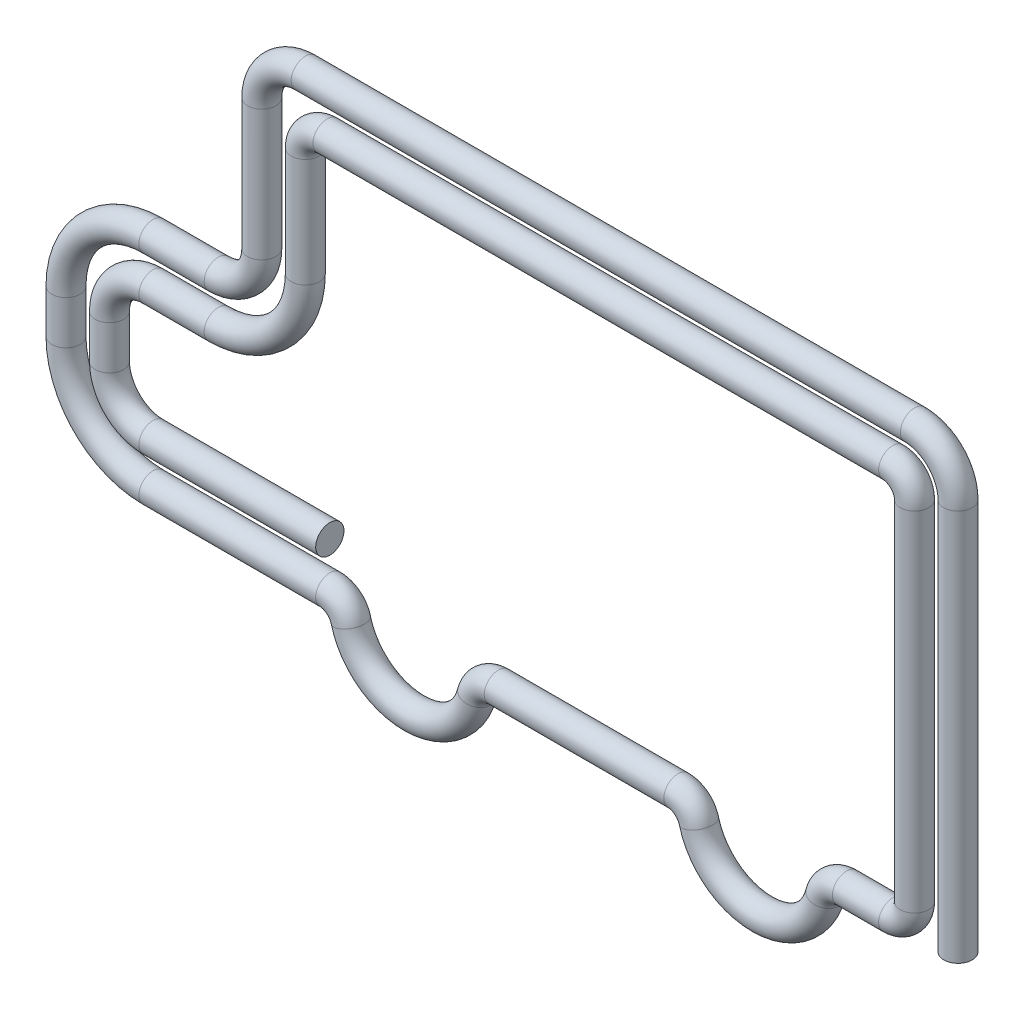
from build123d import *

# Parameters (mm, degrees)
SKETCH_3_R = 0.65


with BuildPart() as part:
    # По траектории1: sweep along a path in Эскиз2
    with BuildLine(Plane.XY) as sweep_1_path:
        Line((17, -10), (17, 8))
        ThreePointArc((17, 8), (16.414213562, 9.414213562), (15, 10))
        Line((15, 10), (-13, 10))
        ThreePointArc((-13, 10), (-14.414213562, 9.414213562), (-15, 8))
        Line((-15, 8), (-15, 2))
        ThreePointArc((-15, 2), (-15.585786438, 0.585786438), (-17, 0))
        Line((-17, 0), (-20, 0))
        ThreePointArc((-20, 0), (-22.828427125, -1.171572875), (-24, -4))
        Line((-24, -4), (-24, -6))
        ThreePointArc((-24, -6), (-22.828427125, -8.828427125), (-20, -10))
        Line((-20, -10), (-11.872983346, -10))
        ThreePointArc((-11.872983346, -10), (-11.260610911, -10.209430585), (-10.90473751, -10.75))
        ThreePointArc((-10.90473751, -10.75), (-8, -13), (-5.09526249, -10.75))
        ThreePointArc((-5.09526249, -10.75), (-4.739389089, -10.209430585), (-4.127016654, -10))
        Line((-4.127016654, -10), (4.127016654, -10))
        ThreePointArc((4.127016654, -10), (4.739389089, -10.209430585), (5.09526249, -10.75))
        ThreePointArc((5.09526249, -10.75), (8, -13), (10.90473751, -10.75))
        ThreePointArc((10.90473751, -10.75), (11.260610911, -10.209430585), (11.872983346, -10))
        Line((11.872983346, -10), (14, -10))
        ThreePointArc((14, -10), (14.707106781, -9.707106781), (15, -9))
        Line((15, -9), (15, 7))
        ThreePointArc((15, 7), (14.707106781, 7.707106781), (14, 8))
        Line((14, 8), (-12, 8))
        ThreePointArc((-12, 8), (-12.707106781, 7.707106781), (-13, 7))
        Line((-13, 7), (-13, 2))
        ThreePointArc((-13, 2), (-14.171572875, -0.828427125), (-17, -2))
        Line((-17, -2), (-20, -2))
        ThreePointArc((-20, -2), (-21.414213562, -2.585786438), (-22, -4))
        Line((-22, -4), (-22, -6))
        ThreePointArc((-22, -6), (-21.414213562, -7.414213562), (-20, -8))
        Line((-20, -8), (-11.872983346, -8))
    # Эскиз3 → По траектории1 (sweep)
    with BuildSketch(Plane(origin=(17, -10, 0), x_dir=(-1, 0, 0), z_dir=(0, -1, 0))):
        Circle(SKETCH_3_R)
    sweep(path=sweep_1_path.line)


solid = part.part
